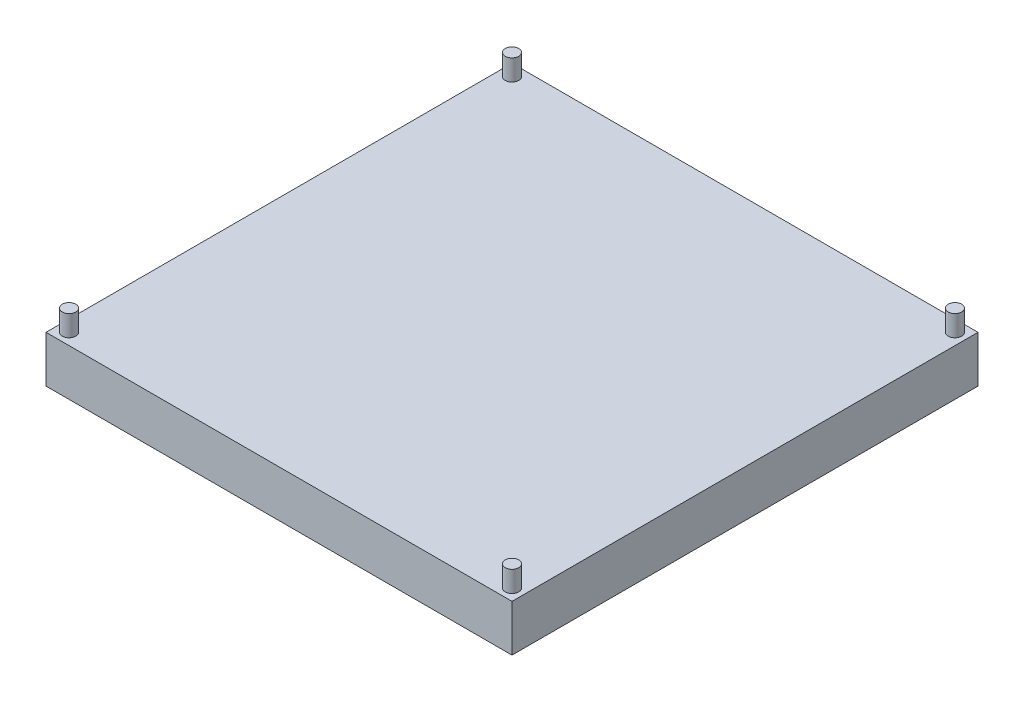
from build123d import *

# Parameters (mm, degrees)
SKETCH1_W           = 50.8
SKETCH1_H           = 50.8
BOSS_EXTRUDE1_DEPTH = 5.08
SKETCH11_R          = 0.7366
BOSS_EXTRUDE2_DEPTH = 2.286
SKETCH12_W          = 45.72
SKETCH12_H          = 45.72
CUT_EXTRUDE1_DEPTH  = 1.27


with BuildPart() as part:
    # Sketch1 → Boss-Extrude1 (new body)
    with BuildSketch(Plane(origin=(0, 0, 0), x_dir=(1, 0, 0), z_dir=(0, 1, 0))):
        Rectangle(SKETCH1_W, SKETCH1_H)
    extrude(amount=BOSS_EXTRUDE1_DEPTH)

    # Sketch11 → Boss-Extrude2 (add)
    with BuildSketch(Plane(origin=(0, 5.08, 0), x_dir=(1, 0, 0), z_dir=(0, 1, 0))):
        with Locations(Location((-24.142764143, 24.142764143, 0), (0, 0, 90))):
            Circle(SKETCH11_R)
        with Locations(Location((24.142764143, 24.142764143, 0), (0, 0, 90))):
            Circle(SKETCH11_R)
        with Locations(Location((24.142764143, -24.142764143, 0), (0, 0, 90))):
            Circle(SKETCH11_R)
        with Locations(Location((-24.142764143, -24.142764143, 0), (0, 0, 90))):
            Circle(SKETCH11_R)
    extrude(amount=BOSS_EXTRUDE2_DEPTH)

    # Sketch12 → Cut-Extrude1 (cut)
    with BuildSketch(Plane.XZ):
        Rectangle(SKETCH12_W, SKETCH12_H)
    extrude(amount=-CUT_EXTRUDE1_DEPTH, mode=Mode.SUBTRACT)


solid = part.part
